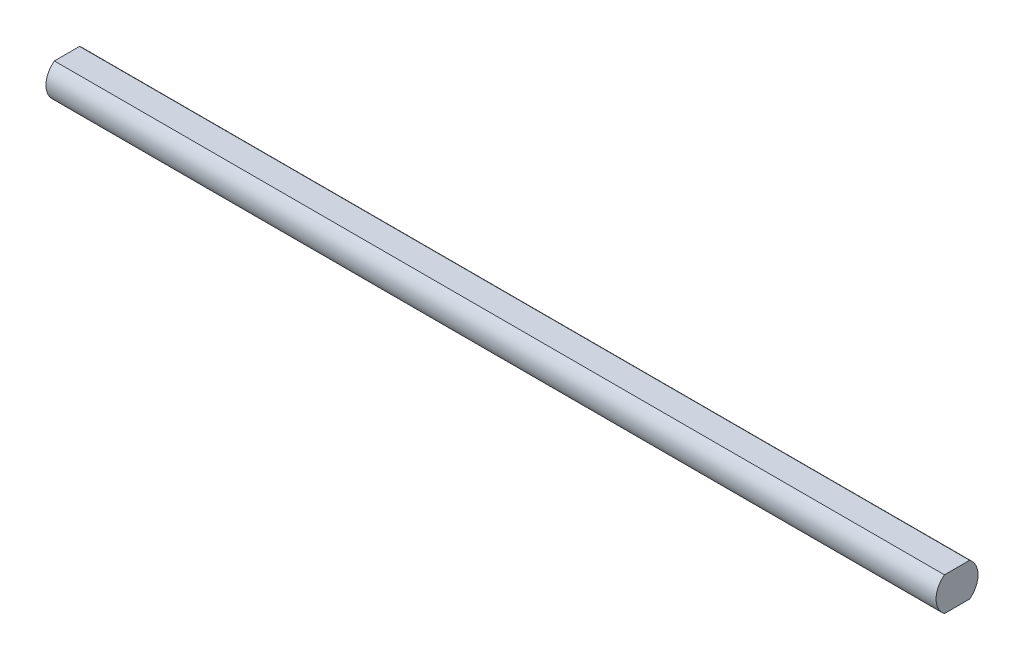
from build123d import *

# Parameters (mm, degrees)
SKETCH1_W          = 212
SKETCH1_H          = 5
CUT_EXTRUDE1_START = -212
CUT_EXTRUDE1_DEPTH = 212


with BuildPart() as part:
    # Sketch1 → Revolve1 (revolve)
    with BuildSketch(Plane.XY, mode=Mode.PRIVATE) as revolve1_sk:
        with Locations((0, -2.5)):
            Rectangle(SKETCH1_W, SKETCH1_H)
    revolve(revolve1_sk.sketch.rotate(Axis((-106, 0, 0), (1, 0, 0)), 270), axis=Axis((-106, 0, 0), (1, 0, 0)))

    # Sketch2 → Cut-Extrude1 (cut)
    with BuildSketch(Plane(origin=(106, 0, 0), x_dir=(0, 0, -1), z_dir=(1, 0, 0)).offset(CUT_EXTRUDE1_START)):
        with BuildLine():
            Line((3, -4), (-3, -4))
            ThreePointArc((-3, -4), (0, -5), (3, -4))
        make_face()
        with BuildLine():
            ThreePointArc((-3, 4), (0, 5), (3, 4))
            Line((3, 4), (-3, 4))
        make_face()
    extrude(amount=CUT_EXTRUDE1_DEPTH, mode=Mode.SUBTRACT)


solid = part.part
